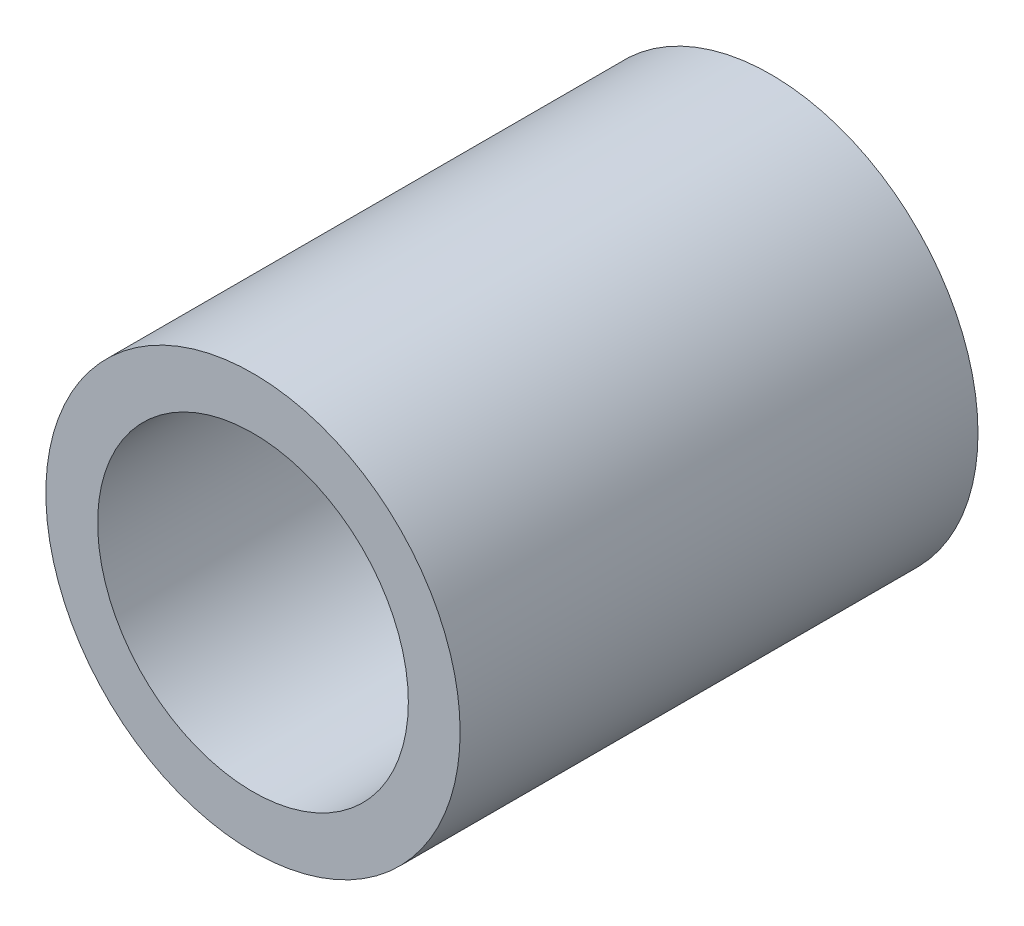
from build123d import *

# Parameters (mm, degrees)
SKETCH1_R           = 8
SKETCH1_R_2         = 6
BOSS_EXTRUDE1_DEPTH = 20


with BuildPart() as part:
    # Sketch1 → Boss-Extrude1 (new body)
    with BuildSketch(Plane.XY):
        Circle(SKETCH1_R)
        Circle(SKETCH1_R_2, mode=Mode.SUBTRACT)
    extrude(amount=BOSS_EXTRUDE1_DEPTH)


solid = part.part
